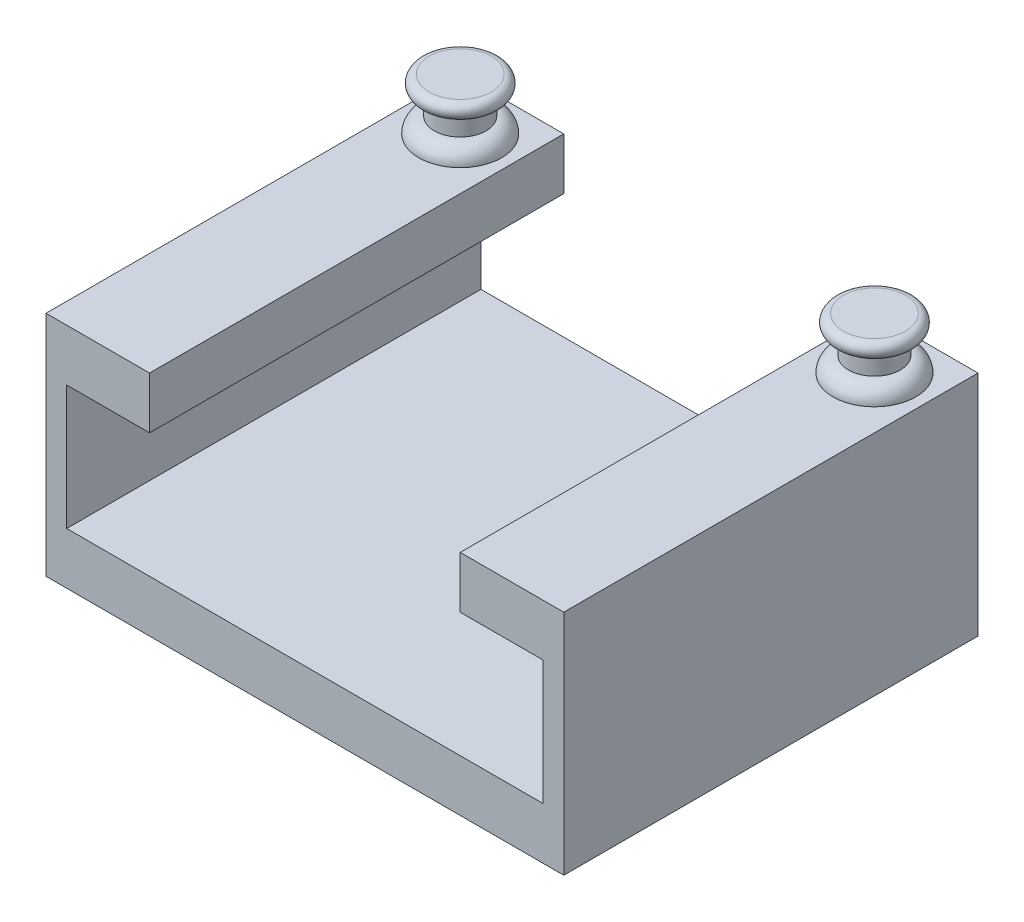
from build123d import *

# Parameters (mm, degrees)
SKETCH1_W           = 50
SKETCH1_H           = 40
BOSS_EXTRUDE2_DEPTH = 5
SKETCH2_W           = 2
SKETCH2_H           = 40
BOSS_EXTRUDE4_DEPTH = 12
SKETCH3_W           = 10
SKETCH3_H           = 40
BOSS_EXTRUDE5_DEPTH = 5


with BuildPart() as part:
    # Sketch1 → Boss-Extrude2 (new body)
    with BuildSketch(Plane(origin=(0, 0, 0), x_dir=(1, 0, 0), z_dir=(0, 1, 0))):
        with Locations((25, 20)):
            Rectangle(SKETCH1_W, SKETCH1_H)
    extrude(amount=BOSS_EXTRUDE2_DEPTH)

    # Sketch2 → Boss-Extrude4 (add)
    with BuildSketch(Plane(origin=(0, 5, 0), x_dir=(1, 0, 0), z_dir=(0, 1, 0))):
        with Locations((1, 20)):
            Rectangle(SKETCH2_W, SKETCH2_H)
        with Locations((49, 20)):
            Rectangle(SKETCH2_W, SKETCH2_H)
    extrude(amount=BOSS_EXTRUDE4_DEPTH)

    # Sketch3 → Boss-Extrude5 (add)
    with BuildSketch(Plane(origin=(0, 17, 0), x_dir=(1, 0, 0), z_dir=(0, 1, 0))):
        with Locations((5, 20)):
            Rectangle(SKETCH3_W, SKETCH3_H)
        with Locations((45, 20)):
            Rectangle(SKETCH3_W, SKETCH3_H)
    extrude(amount=BOSS_EXTRUDE5_DEPTH)

    # Sketch6 → Revolve8 (revolve)
    with BuildSketch(Plane.XY.offset(-35)):
        with BuildLine():
            Line((2.309155678, 22), (5, 22))
            Line((5, 22), (5, 23.5))
            Line((5, 23.5), (5, 25.5))
            Line((5, 25.5), (5, 27))
            Line((5, 27), (2, 27))
            ThreePointArc((2, 27), (1.25, 26.25), (2, 25.5))
            Line((2, 25.5), (2.5, 25.5))
            Line((2.5, 25.5), (2.5, 23.5))
            ThreePointArc((2.5, 23.5), (1.439339828, 23.060660172), (1, 22))
            Line((1, 22), (2.309155678, 22))
        make_face()
    revolve8 = revolve(axis=Axis((5, 22, -35), (0, 1, 0)))

    # Mirror1: Revolve8 across plane
    add(revolve8.mirror(Plane(origin=(25, 0, 0), x_dir=(0, 0, 1), z_dir=(1, 0, 0))))


solid = part.part
